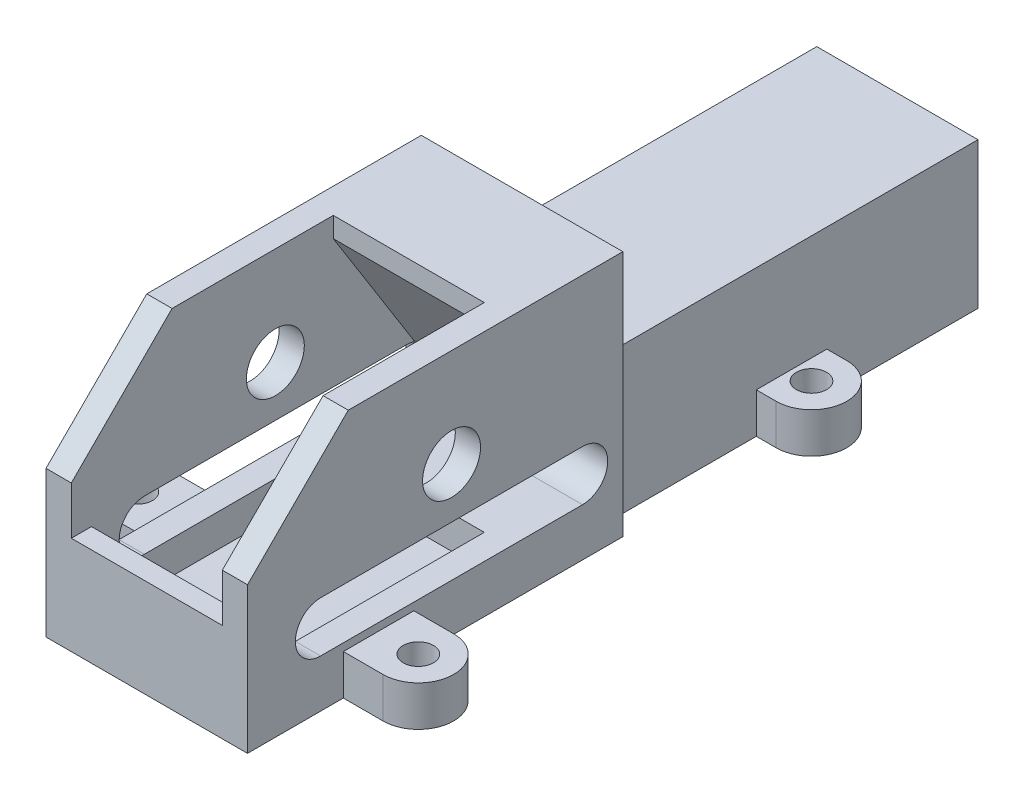
from build123d import *

# Parameters (mm, degrees)
SKETCH1_W               = 16
SKETCH1_H               = 74.5
BOSS_EXTRUDE1_DEPTH     = 14.5
SKETCH2_R               = 1.5
BOSS_EXTRUDE2_DEPTH     = 4
SKETCH3_W               = 2
SKETCH3_H               = 37.25
BOSS_EXTRUDE3_DEPTH     = 14.5
SKETCH4_R               = 1.5
BOSS_EXTRUDE4_DEPTH     = 4
CUT_EXTRUDE1_DEPTH      = 49.487529582
SKETCH7_W               = 20
SKETCH7_H               = 37.25
BOSS_EXTRUDE5_DEPTH     = 10
SKETCH8_W               = 7.5
SKETCH8_H               = 26
SKETCH8_W_2             = 7.486605722
CUT_EXTRUDE2_DEPTH      = 23
SKETCH10_W              = 14.986605722
SKETCH10_H              = 2
BOSS_EXTRUDE6_DEPTH     = 13
CUT_EXTRUDE3_DEPTH      = 14.986605722
SKETCH13_W              = 14.986605722
SKETCH13_H              = 0.75
CUT_EXTRUDE4_DEPTH      = 1
SKETCH14_R              = 2.875
CUT_EXTRUDE5_DEPTH      = 53.354947474
CUT_EXTRUDE6_DEPTH      = 52.088800387
CUT_EXTRUDE6_DEPTH_BACK = 52.088800387
SKETCH16_W              = 14.986605722
SKETCH16_H              = 2
CUT_EXTRUDE7_DEPTH      = 4.75


with BuildPart() as part:
    # Sketch1 → Boss-Extrude1 (new body)
    with BuildSketch(Plane(origin=(0, 0, 0), x_dir=(1, 0, 0), z_dir=(0, 1, 0))):
        Rectangle(SKETCH1_W, SKETCH1_H)
    extrude(amount=BOSS_EXTRUDE1_DEPTH)

    # Sketch2 → Boss-Extrude2 (add)
    with BuildSketch(Plane(origin=(0, 0, 0), x_dir=(-1, 0, 0), z_dir=(0, -1, 0))):
        with BuildLine():
            Line((8, 22.25), (8, 18.75))
            Line((8, 18.75), (8, 15.25))
            Line((8, 15.25), (9.975, 15.25))
            ThreePointArc((9.975, 15.25), (13.475, 18.75), (9.975, 22.25))
            Line((9.975, 22.25), (8, 22.25))
        make_face()
        with Locations(Location((9.975, 18.75, 0), (0, 0, 90))):
            Circle(SKETCH2_R, mode=Mode.SUBTRACT)
    boss_extrude2 = extrude(amount=-BOSS_EXTRUDE2_DEPTH)

    # Mirror1: Boss-Extrude2 across plane
    add(boss_extrude2.mirror(Plane(origin=(0, 0, 0), x_dir=(0, 0, 1), z_dir=(1, 0, 0))))

    # Sketch3 → Boss-Extrude3 (add)
    with BuildSketch(Plane(origin=(0, 0, 0), x_dir=(-1, 0, 0), z_dir=(0, -1, 0))):
        with Locations((9, -18.625)):
            Rectangle(SKETCH3_W, SKETCH3_H)
        with Locations((-9, -18.625)):
            Rectangle(SKETCH3_W, SKETCH3_H)
    extrude(amount=-BOSS_EXTRUDE3_DEPTH)

    # Sketch4 → Boss-Extrude4 (add)
    with BuildSketch(Plane(origin=(0, 0, 0), x_dir=(-1, 0, 0), z_dir=(0, -1, 0))):
        with BuildLine():
            Line((10, -20.74), (10, -27.74))
            Line((10, -27.74), (13.945, -27.74))
            ThreePointArc((13.945, -27.74), (17.445, -24.24), (13.945, -20.74))
            Line((13.945, -20.74), (10, -20.74))
        make_face()
        with Locations(Location((13.945, -24.24, 0), (0, 0, 90))):
            Circle(SKETCH4_R, mode=Mode.SUBTRACT)
    boss_extrude4 = extrude(amount=-BOSS_EXTRUDE4_DEPTH)

    # Mirror4: Boss-Extrude4 across plane
    add(boss_extrude4.mirror(Plane(origin=(0, 0, 0), x_dir=(0, 0, 1), z_dir=(1, 0, 0))))

    # Sketch5 → Cut-Extrude1 (cut, through all)
    with BuildSketch(Plane(origin=(10, 0, 0), x_dir=(0, 0, -1), z_dir=(1, 0, 0))):
        with BuildLine():
            Line((-4, 9.75), (-30, 9.75))
            ThreePointArc((-30, 9.75), (-32.5, 7.25), (-30, 4.75))
            Line((-30, 4.75), (-4, 4.75))
            ThreePointArc((-4, 4.75), (-1.5, 7.25), (-4, 9.75))
        make_face()
    extrude(amount=-CUT_EXTRUDE1_DEPTH, mode=Mode.SUBTRACT)

    # Sketch7 → Boss-Extrude5 (add)
    with BuildSketch(Plane(origin=(0, 14.5, 0), x_dir=(1, 0, 0), z_dir=(0, 1, 0))):
        with Locations((0, -18.625)):
            Rectangle(SKETCH7_W, SKETCH7_H)
    extrude(amount=BOSS_EXTRUDE5_DEPTH)

    # Sketch8 → Cut-Extrude2 (cut)
    with BuildSketch(Plane(origin=(0, 24.5, 0), x_dir=(1, 0, 0), z_dir=(0, 1, 0))):
        with Locations((3.75, -24.25)):
            Rectangle(SKETCH8_W, SKETCH8_H)
        with Locations((-3.743302861, -24.25)):
            Rectangle(SKETCH8_W_2, SKETCH8_H)
    extrude(amount=-CUT_EXTRUDE2_DEPTH, mode=Mode.SUBTRACT)

    # Sketch10 → Boss-Extrude6 (add)
    with BuildSketch(Plane(origin=(0, 1.5, 0), x_dir=(1, 0, 0), z_dir=(0, 1, 0))):
        with Locations((0.006697139, -36.25)):
            Rectangle(SKETCH10_W, SKETCH10_H)
    extrude(amount=BOSS_EXTRUDE6_DEPTH)

    # Sketch12 → Cut-Extrude3 (cut)
    with BuildSketch(Plane.ZY.offset(-7.5)):
        Polygon((11.25, 9.75), (11.25, 22.5), (3.25, 9.75), align=None)
    extrude(amount=CUT_EXTRUDE3_DEPTH, mode=Mode.SUBTRACT)

    # Sketch13 → Cut-Extrude4 (cut)
    with BuildSketch(Plane(origin=(0, 9.75, 0), x_dir=(1, 0, 0), z_dir=(0, 1, 0))):
        with Locations((0.006697139, -3.625)):
            Rectangle(SKETCH13_W, SKETCH13_H)
    extrude(amount=-CUT_EXTRUDE4_DEPTH, mode=Mode.SUBTRACT)

    # Sketch14 → Cut-Extrude5 (cut, through all)
    with BuildSketch(Plane(origin=(10, 0, 0), x_dir=(0, 0, -1), z_dir=(1, 0, 0))):
        with Locations((-17, 14.75)):
            Circle(SKETCH14_R)
    extrude(amount=-CUT_EXTRUDE5_DEPTH, mode=Mode.SUBTRACT)

    # Sketch15 → Cut-Extrude6 (cut, two sides: drawn at the far end of the back side and taken through both)
    with BuildSketch(Plane.ZY.offset(-7.5).offset(-CUT_EXTRUDE6_DEPTH_BACK)):
        Polygon((37.25, 14.5), (37.25, 24.5), (27.25, 24.5), align=None)
    extrude(amount=CUT_EXTRUDE6_DEPTH + CUT_EXTRUDE6_DEPTH_BACK, mode=Mode.SUBTRACT)

    # Sketch16 → Cut-Extrude7 (cut)
    with BuildSketch(Plane(origin=(0, 14.5, 0), x_dir=(1, 0, 0), z_dir=(0, 1, 0))):
        with Locations((0.006697139, -36.25)):
            Rectangle(SKETCH16_W, SKETCH16_H)
    extrude(amount=-CUT_EXTRUDE7_DEPTH, mode=Mode.SUBTRACT)


solid = part.part
